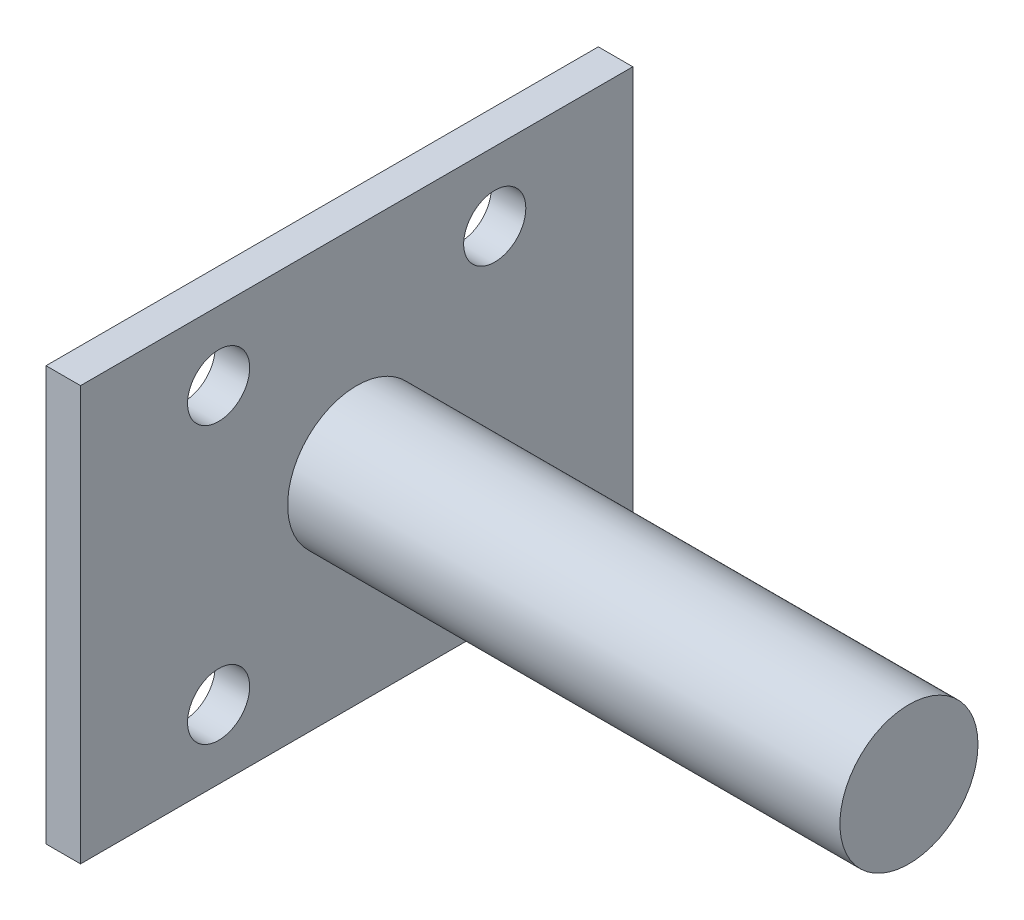
from build123d import *

# Parameters (mm, degrees)
SKETCH1_W           = 40
SKETCH1_H           = 30
BOSS_EXTRUDE1_DEPTH = 2.5
SKETCH2_R           = 5
BOSS_EXTRUDE2_DEPTH = 40
SKETCH4_R           = 2.25
CUT_EXTRUDE1_DEPTH  = 48.16990566


with BuildPart() as part:
    # Sketch1 → Boss-Extrude1 (new body)
    with BuildSketch(Plane(origin=(0, 0, 0), x_dir=(0, 0, -1), z_dir=(1, 0, 0))):
        Rectangle(SKETCH1_W, SKETCH1_H)
    extrude(amount=BOSS_EXTRUDE1_DEPTH)

    # Sketch2 → Boss-Extrude2 (add)
    with BuildSketch(Plane(origin=(2.5, 0, 0), x_dir=(0, 0, -1), z_dir=(1, 0, 0))):
        Circle(SKETCH2_R)
    extrude(amount=BOSS_EXTRUDE2_DEPTH)

    # Sketch4 → Cut-Extrude1 (cut, through all)
    with BuildSketch(Plane(origin=(2.5, 0, 0), x_dir=(0, 0, -1), z_dir=(1, 0, 0))):
        with Locations((-10, 10)):
            Circle(SKETCH4_R)
        with Locations((-10, -10)):
            Circle(SKETCH4_R)
        with Locations((10, 10)):
            Circle(SKETCH4_R)
        with Locations((10, -10)):
            Circle(SKETCH4_R)
    extrude(amount=-CUT_EXTRUDE1_DEPTH, mode=Mode.SUBTRACT)


solid = part.part
